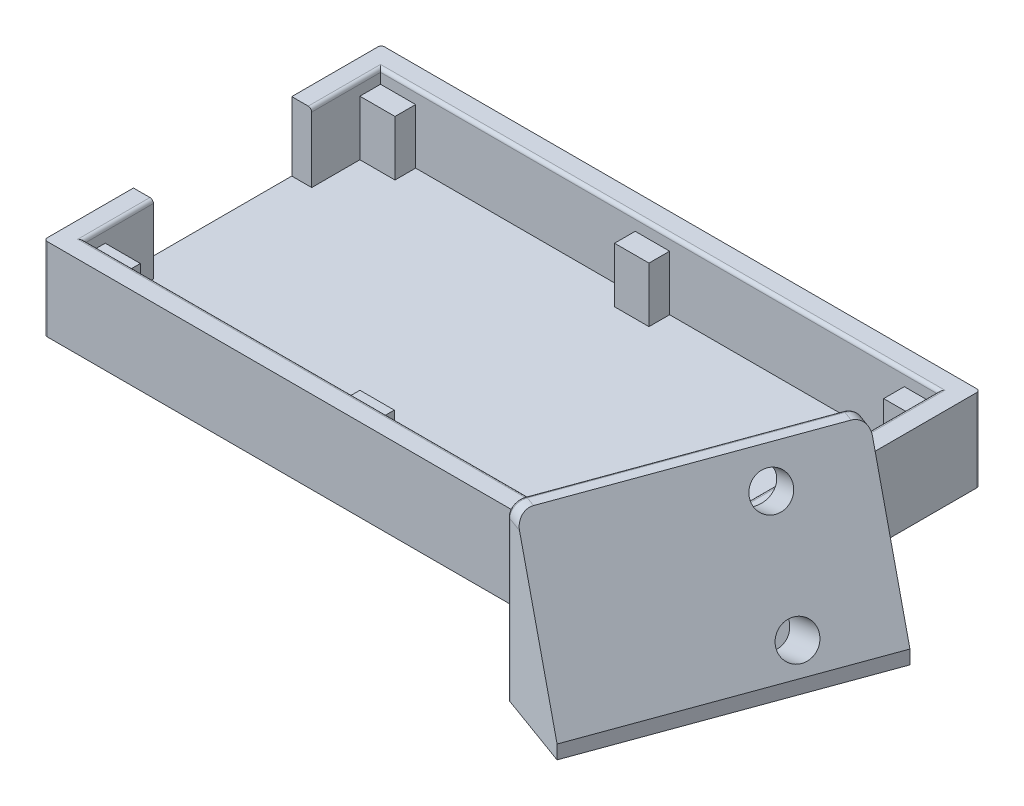
from build123d import *

# Parameters (mm, degrees)
BOSS_EXTRUDE1_DEPTH   = 40
BODY_MOVE_COPY1_ANGLE = 20
BOSS_EXTRUDE2_DEPTH   = 2
BOSS_EXTRUDE3_DEPTH   = 12
SKETCH4_R             = 2.5
CUT_EXTRUDE2_DEPTH    = 8
FILLET1_R             = 2
SKETCH10_W            = 4.9
SKETCH10_H            = 3
SKETCH10_W_2          = 5.1
SKETCH10_W_3          = 5
CUT_EXTRUDE4_DEPTH    = 2
FILLET2_R             = 0.5


with BuildPart() as part:
    # Sketch2 → Boss-Extrude1 (new body)
    with BuildSketch(Plane.XY):
        Polygon((90, 0), (102, 0), (102, 2), (92, 25), (90, 25), align=None)
    extrude(amount=BOSS_EXTRUDE1_DEPTH)


with BuildPart() as part_1:
    # Body-Move/Copy1: moved
    add(part.part.rotate(Axis((95, 0, 20), (0, -1, 0)), BODY_MOVE_COPY1_ANGLE))


with BuildPart() as part_2:
    # Body-Move/Copy2: moved
    add(part_1.part.moved(Location((-4, 0, -25))))

    # Sketch1 → Boss-Extrude2 (add)
    with BuildSketch(Plane(origin=(0, 0, 0), x_dir=(1, 0, 0), z_dir=(0, 1, 0))):
        Polygon((0, 49), (0, 0), (73, 0), (84, -12), (87, 0), (87, 49), align=None)
    extrude(amount=BOSS_EXTRUDE2_DEPTH)

    # Sketch1<4> → Boss-Extrude3 (add)
    with BuildSketch(Plane(origin=(0, 0, 0), x_dir=(1, 0, 0), z_dir=(0, 1, 0))):
        Polygon((8, 43), (8, 46), (39.9, 46), (39.9, 43), (44.9, 43), (44.9, 46), (79, 46), (79, 43), (83.9, 43), (83.9, 6), (79, 6), (79, 3), (44.9, 3), (44.9, 6), (39.9, 6), (39.9, 3), (8, 3), (8, 6), (2.9, 6), (2.9, 13), (0, 13), (0, 0), (73, 0), (87, 0), (87, 49), (0, 49), (0, 36), (2.9, 36), (2.9, 43), align=None)
    extrude(amount=BOSS_EXTRUDE3_DEPTH)

    # Sketch4 → Cut-Extrude2 (cut)
    with BuildSketch(Plane(origin=(72.447790922, 33.520577724, 26.368839434), x_dir=(0.30020671045987535, 0.09758957417323016, -0.948868908757974), z_dir=(0.8617639646050662, 0.3987261114144503, 0.31365643207890637))):
        with Locations(Location((42.044187921, -18.952687866, 0), (0, 0, 92.148700458))):
            Circle(SKETCH4_R)
        with Locations(Location((40.341555526, -34.861837527, 0), (0, 0, 92.148700458))):
            Circle(SKETCH4_R)
    extrude(amount=-CUT_EXTRUDE2_DEPTH, mode=Mode.SUBTRACT)

    # Fillet1
    fillet1_edges = [part_2.edges().sort_by_distance(p)[0] for p in [
        (80.40082665, 25, 12.425771842),
        (94.081632383, 25, -25.161932989),
    ]]
    fillet(fillet1_edges, radius=FILLET1_R)

    # Sketch10 → Cut-Extrude4 (cut)
    with BuildSketch(Plane(origin=(0, 12, 0), x_dir=(1, 0, 0), z_dir=(0, 1, 0))):
        with Locations((81.45, 4.5)):
            Rectangle(SKETCH10_W, SKETCH10_H)
        with Locations((42.45, 4.5)):
            Rectangle(SKETCH10_W_2, SKETCH10_H)
        with Locations((42.4, 44.5)):
            Rectangle(SKETCH10_W_3, SKETCH10_H)
        with Locations((81.45, 44.5)):
            Rectangle(SKETCH10_W, SKETCH10_H)
        with Locations((5.45, 44.5)):
            Rectangle(SKETCH10_W_2, SKETCH10_H)
        with Locations((5.45, 4.5)):
            Rectangle(SKETCH10_W_2, SKETCH10_H)
    extrude(amount=-CUT_EXTRUDE4_DEPTH, mode=Mode.SUBTRACT)

    # Fillet2
    fillet2_edges = [part_2.edges().sort_by_distance(p)[0] for p in [
        (86.301536896, 25, -6.710100717),
        (79.46113403, 11.5, 12.083751699),
        (93.141939763, 11.5, -25.503953132),
        (79.661484791, 24.414213562, 11.533292506),
        (92.941589001, 24.414213562, -24.95349394),
        (87, 6, -49),
        (0, 6, -49),
        (0, 6, 0),
        (2.9, 12, -41),
        (43.4, 12, -46),
        (83.9, 12, -24.5),
        (2.9, 12, -8),
        (43.4, 12, -3),
    ]]
    fillet(fillet2_edges, radius=FILLET2_R)


solid = part_2.part
